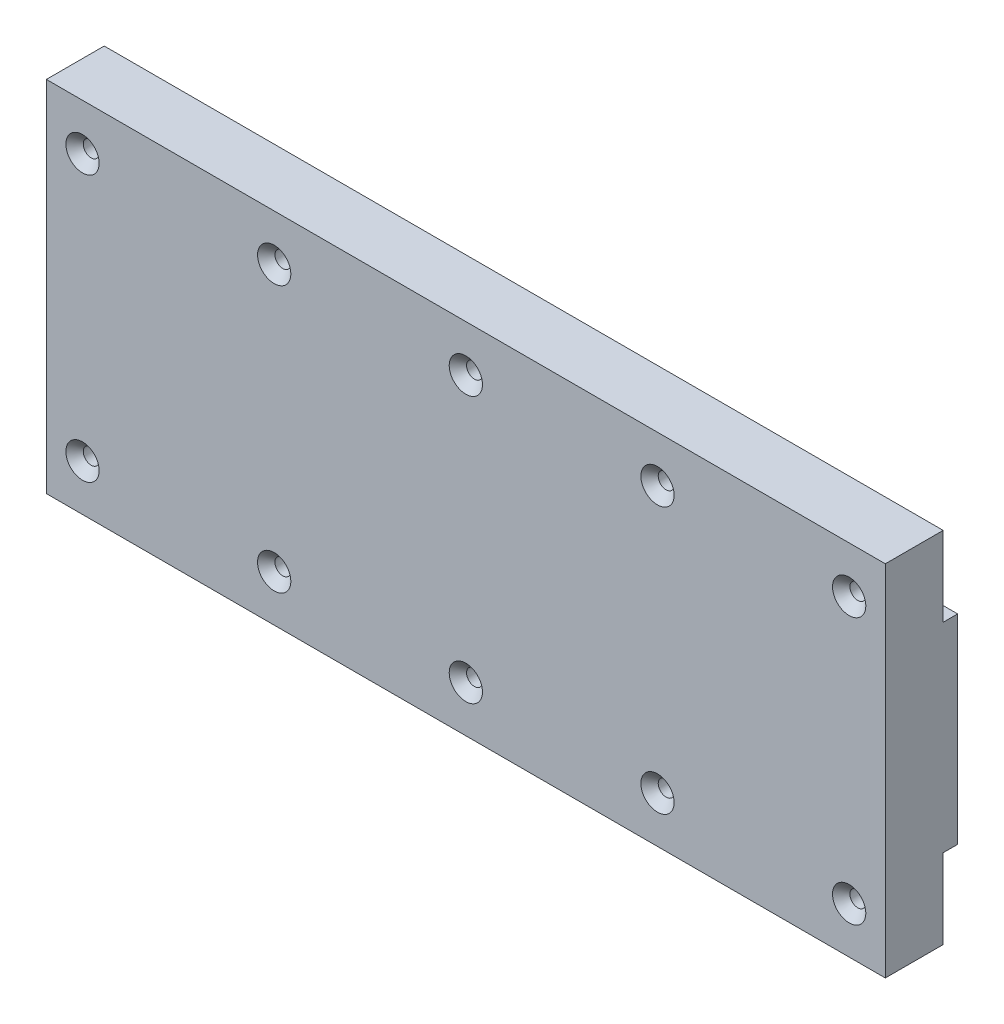
from build123d import *

# Parameters (mm, degrees)
BOSS_EXTRUDE1_DEPTH = 580
SKETCH2_R           = 5.5
CUT_EXTRUDE1_DEPTH  = 596.210886997
CHAMFER1_SIZE       = 6


with BuildPart() as part:
    # Sketch1 → Boss-Extrude1 (new body)
    with BuildSketch(Plane(origin=(0, 0, 0), x_dir=(0, 0, -1), z_dir=(1, 0, 0))):
        Polygon((0, -124), (-40, -124), (-40, 124), (0, 124), (0, 69), (10, 69), (10, -69), (0, -69), align=None)
    extrude(amount=BOSS_EXTRUDE1_DEPTH)

    # Sketch2 → Cut-Extrude1 (cut, through all)
    with BuildSketch(Plane.XY.offset(40)):
        with Locations((25, 92)):
            Circle(SKETCH2_R)
        with Locations((157.5, 92)):
            Circle(SKETCH2_R)
        with Locations(Location((422.5, 92, 0), (0, 0, 270))):
            Circle(SKETCH2_R)
        with Locations(Location((555, 92, 0), (0, 0, 270))):
            Circle(SKETCH2_R)
        with Locations((290, 92)):
            Circle(SKETCH2_R)
        with Locations((555, -92)):
            Circle(SKETCH2_R)
        with Locations((422.5, -92)):
            Circle(SKETCH2_R)
        with Locations(Location((290, -92, 0), (0, 0, 270))):
            Circle(SKETCH2_R)
        with Locations(Location((157.5, -92, 0), (0, 0, 270))):
            Circle(SKETCH2_R)
        with Locations(Location((25, -92, 0), (0, 0, 270))):
            Circle(SKETCH2_R)
    extrude(amount=-CUT_EXTRUDE1_DEPTH, mode=Mode.SUBTRACT)

    # Chamfer1
    chamfer1_edges = [part.edges().sort_by_distance(p)[0] for p in [
        (25, -86.5, 40),
        (157.5, -86.5, 40),
        (290, -86.5, 40),
        (417, -92, 40),
        (549.5, -92, 40),
        (152, 92, 40),
        (422.5, 97.5, 40),
        (555, 97.5, 40),
        (284.5, 92, 40),
        (19.5, 92, 40),
    ]]
    chamfer(chamfer1_edges, length=CHAMFER1_SIZE)


solid = part.part
